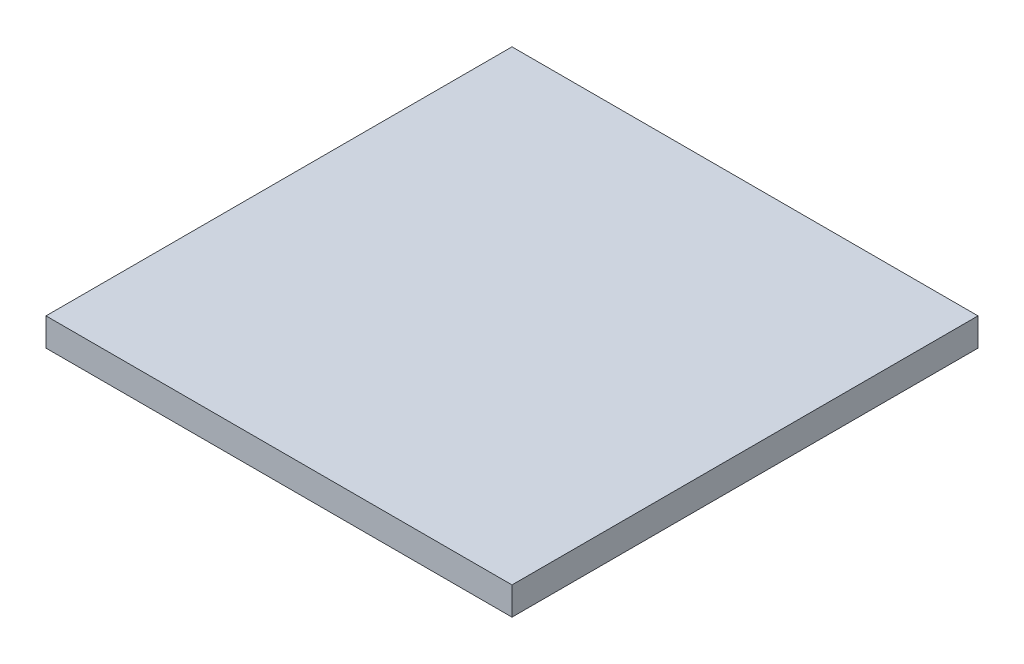
from build123d import *

# Parameters (mm, degrees)
SKETCH1_W           = 500
SKETCH1_H           = 500
BOSS_EXTRUDE1_DEPTH = 30


with BuildPart() as part:
    # Sketch1 → Boss-Extrude1 (new body)
    with BuildSketch(Plane(origin=(0, 0, 0), x_dir=(1, 0, 0), z_dir=(0, 1, 0))):
        Rectangle(SKETCH1_W, SKETCH1_H)
    extrude(amount=BOSS_EXTRUDE1_DEPTH)


solid = part.part
